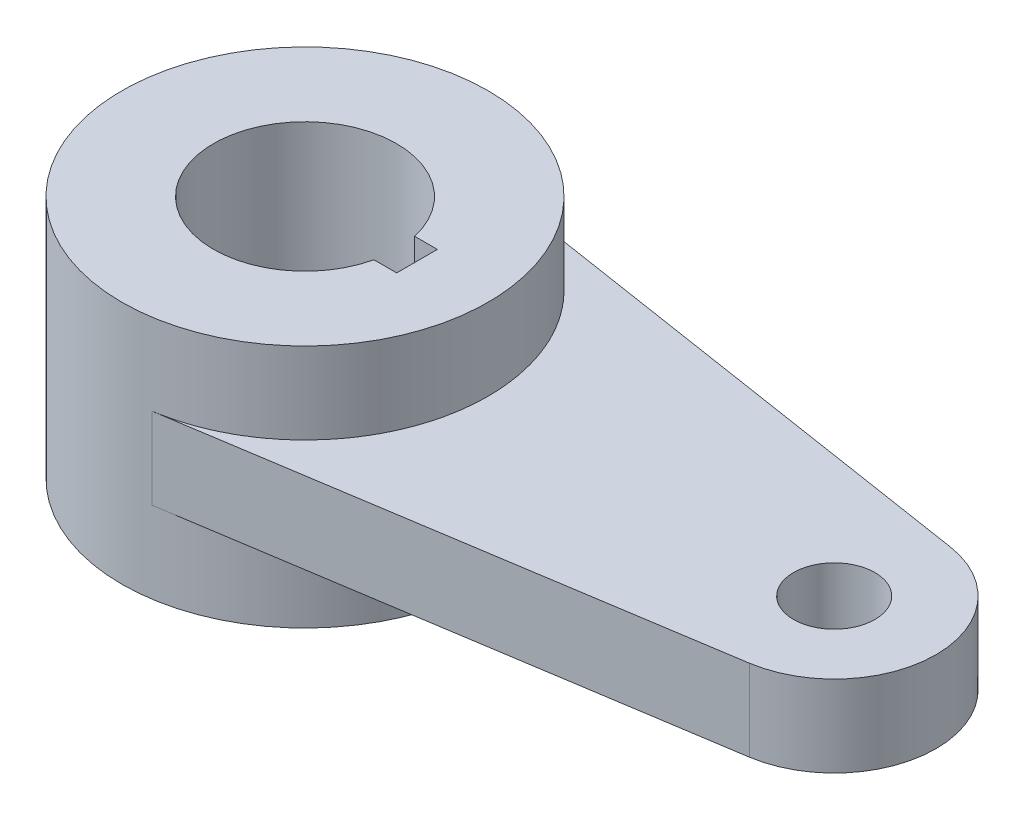
from build123d import *

# Parameters (mm, degrees)
SKETCH4_R           = 28.575
SKETCH4_R_2         = 14.2875
BOSS_EXTRUDE1_DEPTH = 19.05
SKETCH5_R           = 6.35
BOSS_EXTRUDE2_DEPTH = 6.35
SKETCH6_W           = 17.4752
SKETCH6_H           = 6.35
CUT_EXTRUDE2_DEPTH  = 38.1


with BuildPart() as part:
    # Sketch4 → Boss-Extrude1 (new, symmetric)
    with BuildSketch(Plane(origin=(0, 0, 0), x_dir=(1, 0, 0), z_dir=(0, 1, 0))):
        with Locations(Location((0, 0, 0), (0, 0, 90))):
            Circle(SKETCH4_R)
        with Locations(Location((0, 0, 0), (0, 0, 90))):
            Circle(SKETCH4_R_2, mode=Mode.SUBTRACT)
    extrude(amount=BOSS_EXTRUDE1_DEPTH, both=True)

    # Sketch6 → Cut-Extrude2 (cut)
    with BuildSketch(Plane(origin=(0, 19.05, 0), x_dir=(1, 0, 0), z_dir=(0, 1, 0))):
        with Locations((8.7376, 0)):
            Rectangle(SKETCH6_W, SKETCH6_H)
    extrude(amount=-CUT_EXTRUDE2_DEPTH, mode=Mode.SUBTRACT)


with BuildPart() as body_2:
    # Sketch5 → Boss-Extrude2 (new, symmetric)
    with BuildSketch(Plane(origin=(0, 0, 0), x_dir=(1, 0, 0), z_dir=(0, 1, 0))):
        with BuildLine():
            Line((4.396153846, 28.234809303), (84.992307692, 15.686005168))
            ThreePointArc((84.992307692, 15.686005168), (98.425, 0), (84.992307692, -15.686005168))
            Line((84.992307692, -15.686005168), (4.396153846, -28.234809303))
            ThreePointArc((4.396153846, -28.234809303), (28.575, 0), (4.396153846, 28.234809303))
        make_face()
        with Locations(Location((82.55, 0, 0), (0, 0, 270))):
            Circle(SKETCH5_R, mode=Mode.SUBTRACT)
    extrude(amount=BOSS_EXTRUDE2_DEPTH, both=True)


solid = Compound([part.part, body_2.part])
